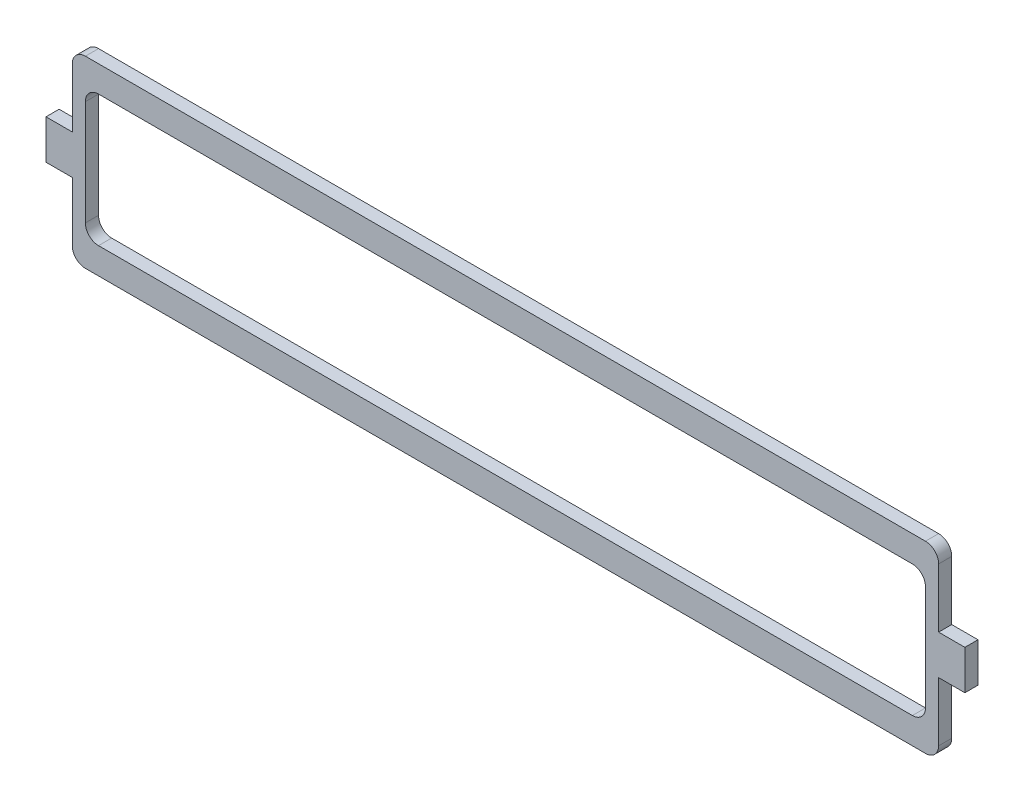
from build123d import *

# Parameters (mm, degrees)
BOSS_EXTRUDE1_DEPTH     = 5
ESQUISSE1_W             = 320
ESQUISSE1_H             = 50
ENL_V_MAT_EXTRU_1_DEPTH = 10
CONG_1_R                = 5


with BuildPart() as part:
    # Sketch1 → Boss-Extrude1 (new body)
    with BuildSketch(Plane.XY):
        Polygon((-75.813253012, 35), (254.186746988, 35), (254.186746988, 17.5), (254.186746988, 7.5), (264.186746988, 7.5), (264.186746988, -7.5), (254.186746988, -7.5), (254.186746988, -17.5), (254.186746988, -35), (-75.813253012, -35), (-75.813253012, -17.5), (-75.813253012, -7.5), (-85.813253012, -7.5), (-85.813253012, 7.5), (-75.813253012, 7.5), (-75.813253012, 17.5), align=None)
    extrude(amount=BOSS_EXTRUDE1_DEPTH)

    # Esquisse1 → Enlèv. mat.-Extru.1 (cut)
    with BuildSketch(Plane.XY.offset(5)):
        with Locations((89.186746988, 0)):
            Rectangle(ESQUISSE1_W, ESQUISSE1_H)
    extrude(amount=-ENL_V_MAT_EXTRU_1_DEPTH, mode=Mode.SUBTRACT)

    # Congé1
    cong_1_edges = [part.edges().sort_by_distance(p)[0] for p in [
        (-75.813253012, 35, 2.5),
        (254.186746988, 35, 2.5),
        (254.186746988, -35, 2.5),
        (-75.813253012, -35, 2.5),
        (-70.813253012, -25, 2.5),
        (-70.813253012, 25, 2.5),
        (249.186746988, 25, 2.5),
        (249.186746988, -25, 2.5),
    ]]
    fillet(cong_1_edges, radius=CONG_1_R)


solid = part.part
